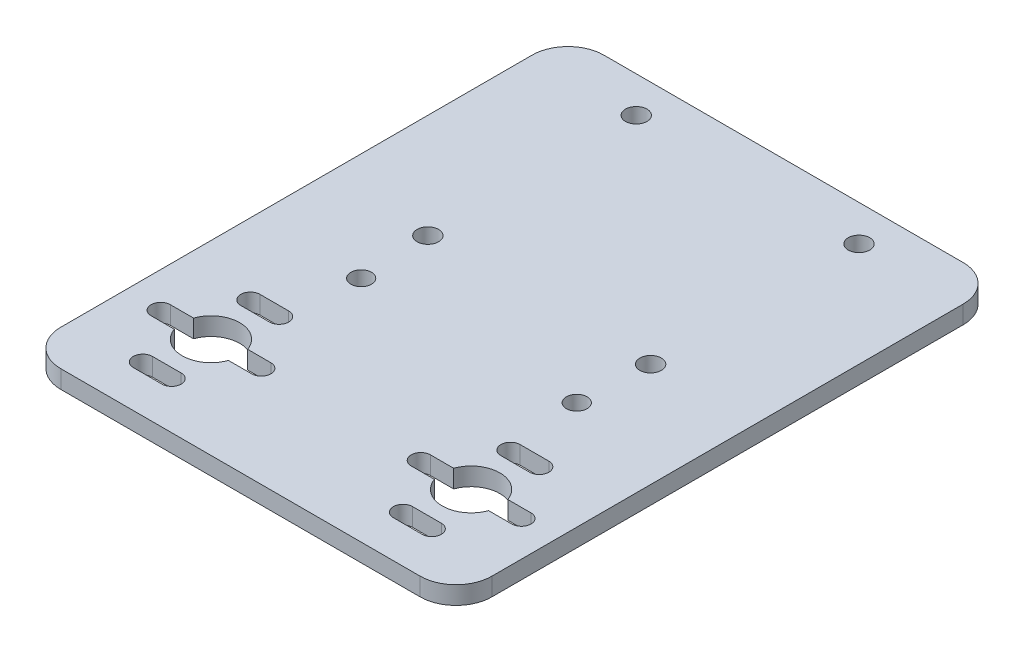
from build123d import *

# Parameters (mm, degrees)
SKETCH1_W             = 76.2
SKETCH1_H             = 38.1
BOSS_EXTRUDE1_DEPTH   = 3.175
CUT_EXTRUDE1_DEPTH    = 43.715256349
SKETCH5_W             = 76.2
SKETCH5_H             = 57.8866
BOSS_EXTRUDE3_DEPTH   = 3.175
F_6_CLEARANCE_HOLE1_D = 3.6576
FILLET1_R             = 6.35
F_6_CLEARANCE_HOLE2_D = 3.7973


with BuildPart() as part:
    # Sketch1 → Boss-Extrude1 (new body)
    with BuildSketch(Plane(origin=(0, 0, 0), x_dir=(1, 0, 0), z_dir=(0, 1, 0))):
        Rectangle(SKETCH1_W, SKETCH1_H)
    extrude(amount=BOSS_EXTRUDE1_DEPTH)

    # Sketch3 → Cut-Extrude1 (cut, through all)
    with BuildSketch(Plane.XZ):
        with BuildLine():
            Line((-20.447, 12.47), (-25.527, 12.47))
            ThreePointArc((-25.527, 12.47), (-27.227, 10.77), (-25.527, 9.07))
            Line((-25.527, 9.07), (-20.447, 9.07))
            ThreePointArc((-20.447, 9.07), (-18.747, 10.77), (-20.447, 12.47))
        make_face()
        with BuildLine():
            Line((-27.774107686, 2.97), (-31.877, 2.97))
            ThreePointArc((-31.877, 2.97), (-33.577, 1.27), (-31.877, -0.43))
            Line((-31.877, -0.43), (-27.774107686, -0.43))
            ThreePointArc((-27.774107686, -0.43), (-28.067, 1.27), (-27.774107686, 2.97))
        make_face()
        with BuildLine():
            Line((-18.199892314, 2.97), (-27.774107686, 2.97))
            ThreePointArc((-27.774107686, 2.97), (-28.067, 1.27), (-27.774107686, -0.43))
            Line((-27.774107686, -0.43), (-18.199892314, -0.43))
            ThreePointArc((-18.199892314, -0.43), (-17.980758543, 0.40747668), (-17.907, 1.27))
            ThreePointArc((-17.907, 1.27), (-17.980758543, 2.13252332), (-18.199892314, 2.97))
        make_face()
        with BuildLine():
            ThreePointArc((-18.199892314, 2.97), (-22.987, 6.35), (-27.774107686, 2.97))
            Line((-27.774107686, 2.97), (-18.199892314, 2.97))
        make_face()
        with BuildLine():
            Line((-14.097, 2.97), (-18.199892314, 2.97))
            ThreePointArc((-18.199892314, 2.97), (-17.980758543, 2.13252332), (-17.907, 1.27))
            ThreePointArc((-17.907, 1.27), (-17.980758543, 0.40747668), (-18.199892314, -0.43))
            Line((-18.199892314, -0.43), (-14.097, -0.43))
            ThreePointArc((-14.097, -0.43), (-12.397, 1.27), (-14.097, 2.97))
        make_face()
        with BuildLine():
            Line((-18.199892314, -0.43), (-27.774107686, -0.43))
            ThreePointArc((-27.774107686, -0.43), (-22.987, -3.81), (-18.199892314, -0.43))
        make_face()
        with BuildLine():
            Line((-25.527, -9.93), (-20.447, -9.93))
            ThreePointArc((-20.447, -9.93), (-18.747, -8.23), (-20.447, -6.53))
            Line((-20.447, -6.53), (-25.527, -6.53))
            ThreePointArc((-25.527, -6.53), (-27.227, -8.23), (-25.527, -9.93))
        make_face()
    cut_extrude1 = extrude(amount=-CUT_EXTRUDE1_DEPTH, mode=Mode.SUBTRACT)

    # Mirror1: Cut-Extrude1 across plane
    add(cut_extrude1.mirror(Plane(origin=(0, 0, 0), x_dir=(0, 0, 1), z_dir=(1, 0, 0))), mode=Mode.SUBTRACT)

    # Sketch5 → Boss-Extrude3 (add)
    with BuildSketch(Plane(origin=(0, 0, 0), x_dir=(1, 0, 0), z_dir=(0, 1, 0))):
        with Locations((0, 47.9933)):
            Rectangle(SKETCH5_W, SKETCH5_H)
    extrude(amount=BOSS_EXTRUDE3_DEPTH)

    # #6 Clearance Hole1 (through all)
    with Locations(Plane(origin=(0, 3.175, 0), x_dir=(1, 0, 0), z_dir=(0, 1, 0))):
        with Locations((-19.05, 21.336), (19.05, 21.336)):
            Hole(F_6_CLEARANCE_HOLE1_D / 2)

    # Fillet1
    fillet1_edges = [part.edges().sort_by_distance(p)[0] for p in [
        (-38.1, 1.5875, -76.9366),
        (38.1, 1.5875, -76.9366),
        (38.1, 1.5875, 19.05),
        (-38.1, 1.5875, 19.05),
    ]]
    fillet(fillet1_edges, radius=FILLET1_R)

    # #6 Clearance Hole2 (through all)
    with Locations(Plane(origin=(0, 0, 0), x_dir=(-1, 0, 0), z_dir=(0, -1, 0))):
        with Locations((19.685, 70.5866), (19.685, 33.7566), (-19.685, 70.5866), (-19.685, 33.7566)):
            Hole(F_6_CLEARANCE_HOLE2_D / 2)


solid = part.part
